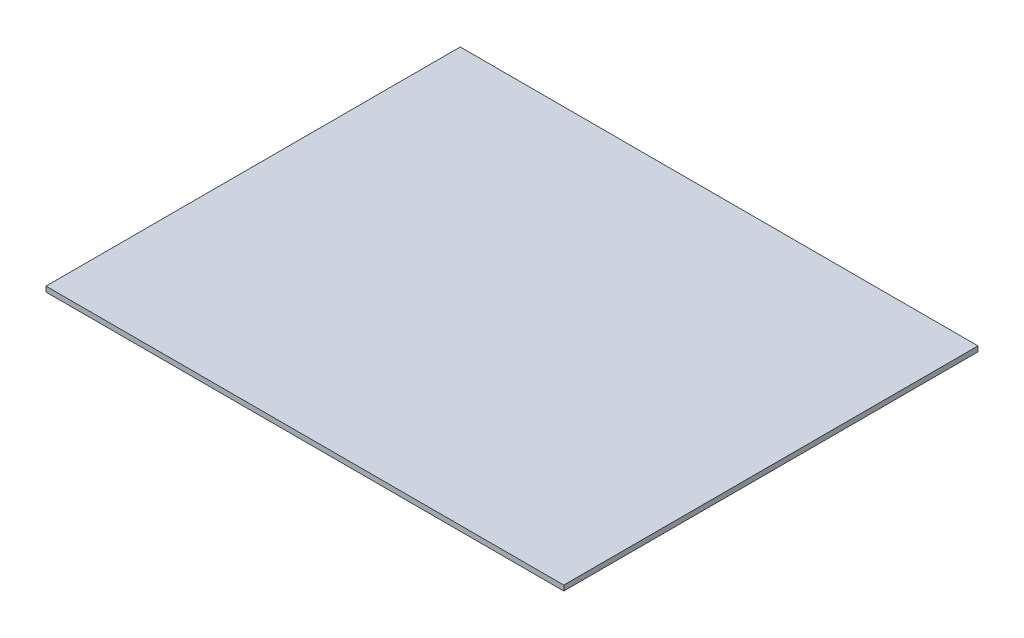
from build123d import *

# Parameters (mm, degrees)
SKETCH1_W           = 500
SKETCH1_H           = 400
BOSS_EXTRUDE1_DEPTH = 5


with BuildPart() as part:
    # Sketch1 → Boss-Extrude1 (new body)
    with BuildSketch(Plane(origin=(0, 0, 0), x_dir=(1, 0, 0), z_dir=(0, 1, 0))):
        Rectangle(SKETCH1_W, SKETCH1_H)
    extrude(amount=BOSS_EXTRUDE1_DEPTH)


solid = part.part
